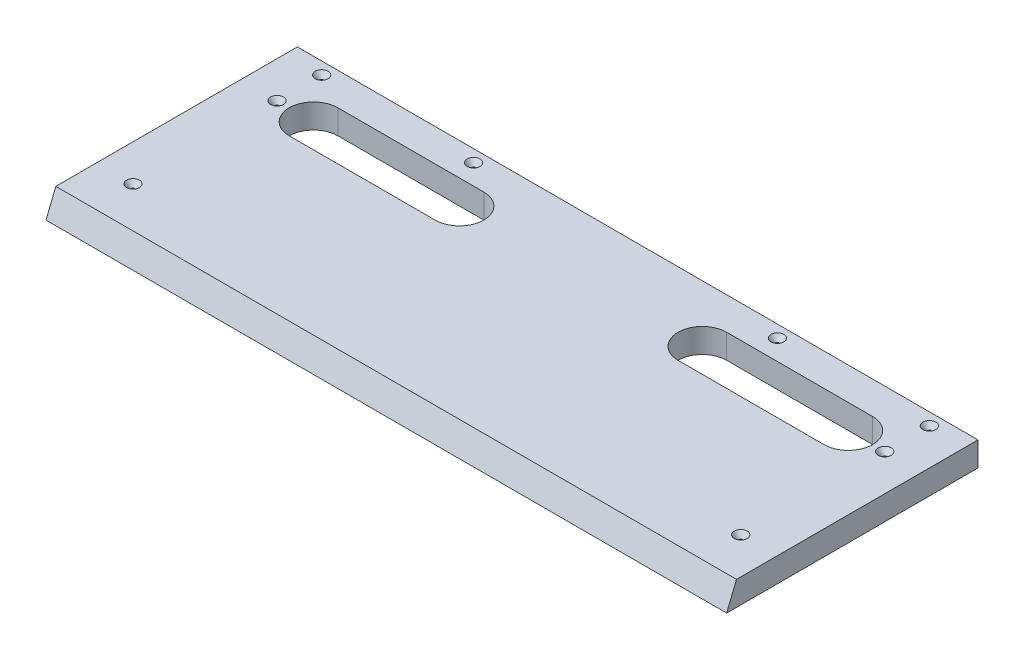
from build123d import *

# Parameters (mm, degrees)
SKETCH1_W           = 533.146
SKETCH1_H           = 196.863399688
BOSS_EXTRUDE1_DEPTH = 19.05
CUT_EXTRUDE1_DEPTH  = 7702.120410186
CUT_EXTRUDE2_DEPTH  = 7008.877833132
HOLE1_D             = 3.175
HOLE1_DEPTH         = 38.1
HOLE1_CSINK_D       = 10.16
HOLE1_CSINK_ANGLE   = 82
HOLE1_TIP           = 0.953866233


with BuildPart() as part:
    # Sketch1 → Boss-Extrude1 (new body)
    with BuildSketch(Plane(origin=(0, 3140.71, 0), x_dir=(1, 0, 0), z_dir=(0, 1, 0))):
        with Locations((0, 6904.348295077)):
            Rectangle(SKETCH1_W, SKETCH1_H)
    extrude(amount=BOSS_EXTRUDE1_DEPTH)

    # Sketch2 → Cut-Extrude1 (cut, through all)
    with BuildSketch(Plane(origin=(266.573, 0, 0), x_dir=(0, 0, -1), z_dir=(1, 0, 0))):
        Polygon((6805.916595233, 3140.710000001), (6813.613294835, 3159.760000001), (6805.916595233, 3159.760000001), align=None)
    extrude(amount=-CUT_EXTRUDE1_DEPTH, mode=Mode.SUBTRACT)

    # Sketch3 → Cut-Extrude2 (cut, through all)
    with BuildSketch(Plane(origin=(0, 3159.76, 0), x_dir=(1, 0, 0), z_dir=(0, 1, 0))):
        with BuildLine():
            Line((209.423, 6939.279994921), (95.123, 6939.279994921))
            ThreePointArc((95.123, 6939.279994921), (76.073, 6958.329994921), (95.123, 6977.379994921))
            Line((95.123, 6977.379994921), (209.423, 6977.379994921))
            ThreePointArc((209.423, 6977.379994921), (228.473, 6958.329994921), (209.423, 6939.279994921))
        make_face()
        with BuildLine():
            Line((-209.423, 6939.279994921), (-95.123, 6939.279994921))
            ThreePointArc((-95.123, 6939.279994921), (-76.073, 6958.329994921), (-95.123, 6977.379994921))
            Line((-95.123, 6977.379994921), (-209.423, 6977.379994921))
            ThreePointArc((-209.423, 6977.379994921), (-228.473, 6958.329994921), (-209.423, 6939.279994921))
        make_face()
    extrude(amount=-CUT_EXTRUDE2_DEPTH, mode=Mode.SUBTRACT)

    # Hole1
    with Locations(Plane(origin=(0, 3159.76, 0), x_dir=(1, 0, 0), z_dir=(0, 1, 0))):
        with Locations((-118.999, 6993.254994921), (237.998, 6993.254994921), (237.998, 6958.329994921), (237.998, 6845.512682081), (-237.998, 6993.254994921), (-237.998, 6958.329994921), (-237.998, 6845.512682081), (118.999, 6993.254994921)):
            CounterSinkHole(HOLE1_D / 2, HOLE1_CSINK_D / 2, depth=HOLE1_DEPTH, counter_sink_angle=HOLE1_CSINK_ANGLE)
            with Locations((0, 0, -(HOLE1_DEPTH + HOLE1_TIP / 2))):  # 118° drill point
                Cone(0, HOLE1_D / 2, HOLE1_TIP, mode=Mode.SUBTRACT)


solid = part.part
